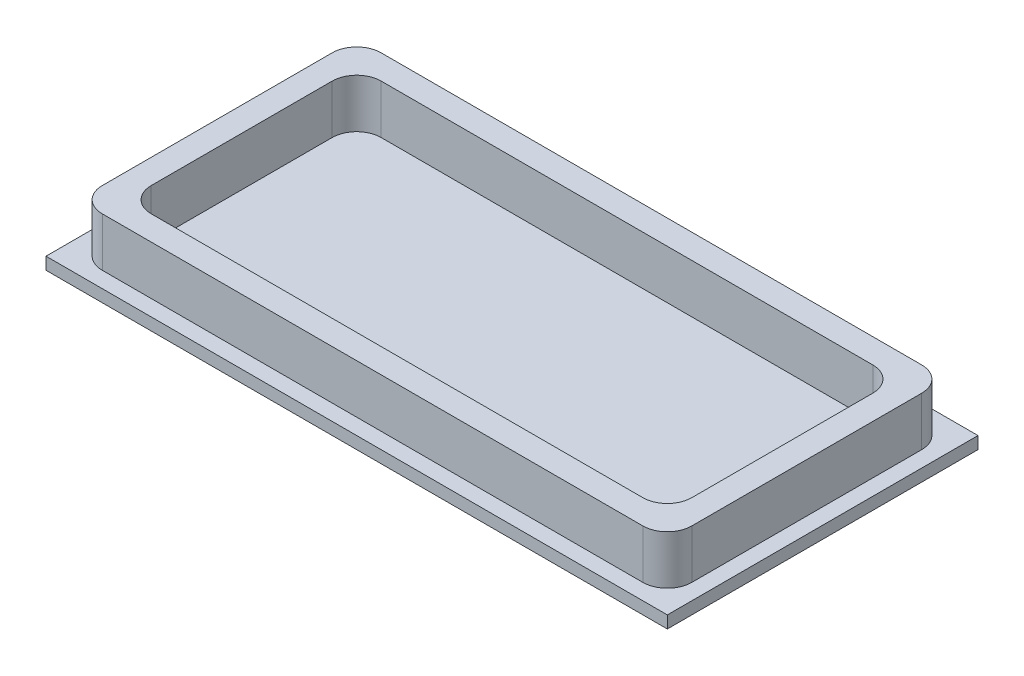
from build123d import *

# Parameters (mm, degrees)
SKETCH1_W           = 50.8
SKETCH1_H           = 25.4
BOSS_EXTRUDE1_DEPTH = 1
SKETCH2_W           = 48.2
SKETCH2_H           = 22.8
SKETCH2_W_2         = 44.2
SKETCH2_H_2         = 18.8
BOSS_EXTRUDE2_DEPTH = 4
FILLET1_R           = 2


with BuildPart() as part:
    # Sketch1 → Boss-Extrude1 (new body)
    with BuildSketch(Plane(origin=(0, 0, 0), x_dir=(1, 0, 0), z_dir=(0, 1, 0))):
        Rectangle(SKETCH1_W, SKETCH1_H)
    extrude(amount=BOSS_EXTRUDE1_DEPTH)

    # Sketch2 → Boss-Extrude2 (add)
    with BuildSketch(Plane(origin=(0, 1, 0), x_dir=(1, 0, 0), z_dir=(0, 1, 0))):
        Rectangle(SKETCH2_W, SKETCH2_H)
        Rectangle(SKETCH2_W_2, SKETCH2_H_2, mode=Mode.SUBTRACT)
    extrude(amount=BOSS_EXTRUDE2_DEPTH)

    # Fillet1
    fillet1_edges = [part.edges().sort_by_distance(p)[0] for p in [
        (24.1, 3, 11.4),
        (24.1, 3, -11.4),
        (-24.1, 3, -11.4),
        (-24.1, 3, 11.4),
        (-22.1, 3, -9.4),
        (-22.1, 3, 9.4),
        (22.1, 3, 9.4),
        (22.1, 3, -9.4),
    ]]
    fillet(fillet1_edges, radius=FILLET1_R)


solid = part.part
